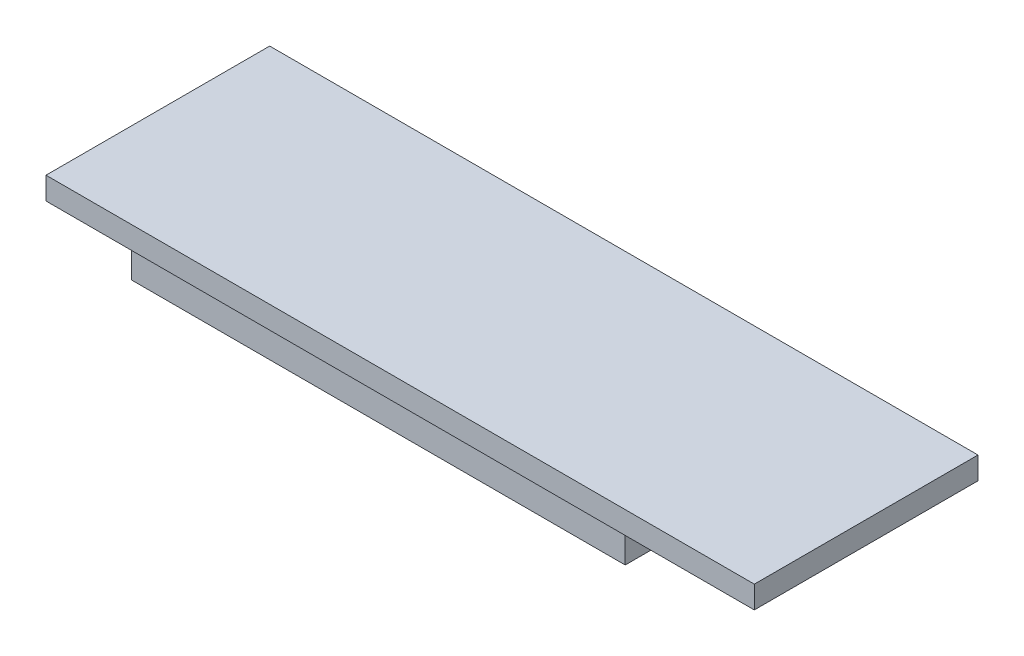
from build123d import *

# Parameters (mm, degrees)
SKETCH1_W           = 38
SKETCH1_H           = 12
BOSS_EXTRUDE1_DEPTH = 0.6
SKETCH2_W           = 26.5
SKETCH2_H           = 11.55
BOSS_EXTRUDE2_DEPTH = 1.6


with BuildPart() as part:
    # Sketch1 → Boss-Extrude1 (new, symmetric)
    with BuildSketch(Plane(origin=(0, 0, 0), x_dir=(1, 0, 0), z_dir=(0, 1, 0))):
        Rectangle(SKETCH1_W, SKETCH1_H)
    extrude(amount=BOSS_EXTRUDE1_DEPTH, both=True)

    # Sketch2 → Boss-Extrude2 (add)
    with BuildSketch(Plane.XZ.offset(0.6)):
        with Locations((-1.4, 0)):
            Rectangle(SKETCH2_W, SKETCH2_H)
    extrude(amount=BOSS_EXTRUDE2_DEPTH)


solid = part.part
